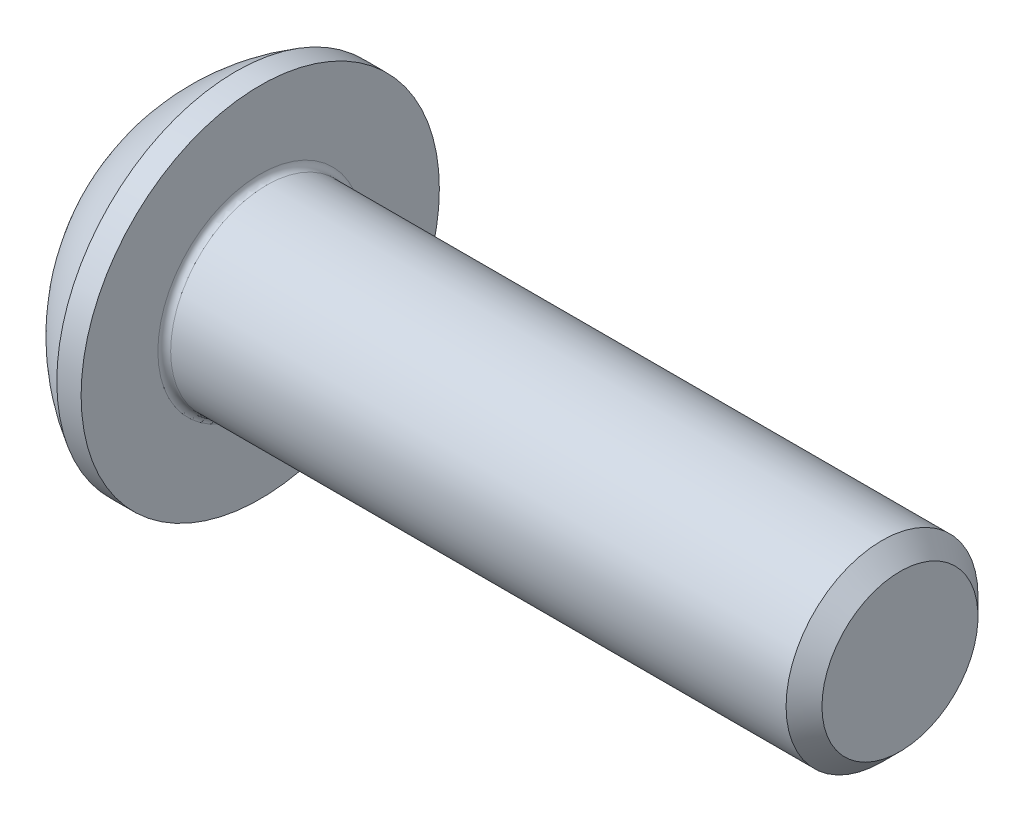
from build123d import *

# Parameters (mm, degrees)
FILLET1_R   = 0.1
HEX_2_DEPTH = 1.04


with BuildPart() as part:
    # BodySke → BaseBody (revolve)
    with BuildSketch(Plane.XY, mode=Mode.PRIVATE) as basebody_sk:
        with BuildLine():
            Line((11.7, 0), (11.7, 1.2195))
            Line((11.7, 1.2195), (11.4195, 1.5))
            Line((11.4195, 1.5), (1.7, 1.5))
            Line((1.7, 1.5), (1.7, 2.8))
            Line((1.7, 2.8), (1.32, 2.8))
            ThreePointArc((1.32, 2.8), (0.552589922, 2.201272359), (0, 1.4))
            Line((0, 1.4), (0, 0))
            Line((0, 0), (11.7, 0))
        make_face()
    revolve(basebody_sk.sketch.rotate(Axis((0, 0, 0), (1, 0, 0)), 90), axis=Axis((0, 0, 0), (1, 0, 0)))

    # Fillet1
    fillet1_edges = [part.edges().sort_by_distance(p)[0] for p in [
        (1.7, 0, -1.5),
    ]]
    fillet(fillet1_edges, radius=FILLET1_R)

    # Sketch2 → PreBroach (revolve, cut)
    with BuildSketch(Plane.XY, mode=Mode.PRIVATE) as prebroach_sk:
        Polygon((0, 1), (1.04, 1), (1.617350269, 0), (0, 0), align=None)
    revolve(prebroach_sk.sketch.rotate(Axis((0, 0, 0), (1, 0, 0)), 90), axis=Axis((0, 0, 0), (1, 0, 0)), mode=Mode.SUBTRACT)

    # Sketch3 → Hex 2 (cut)
    with BuildSketch(Plane(origin=(0, 0, 0), x_dir=(0, 0, -1), z_dir=(1, 0, 0))):
        Polygon((-1, -0.577350269), (-1, 0.577350269), (0, 1.154700538), (1, 0.577350269), (1, -0.577350269), (0, -1.154700538), align=None)
    extrude(amount=HEX_2_DEPTH, mode=Mode.SUBTRACT)


solid = part.part
